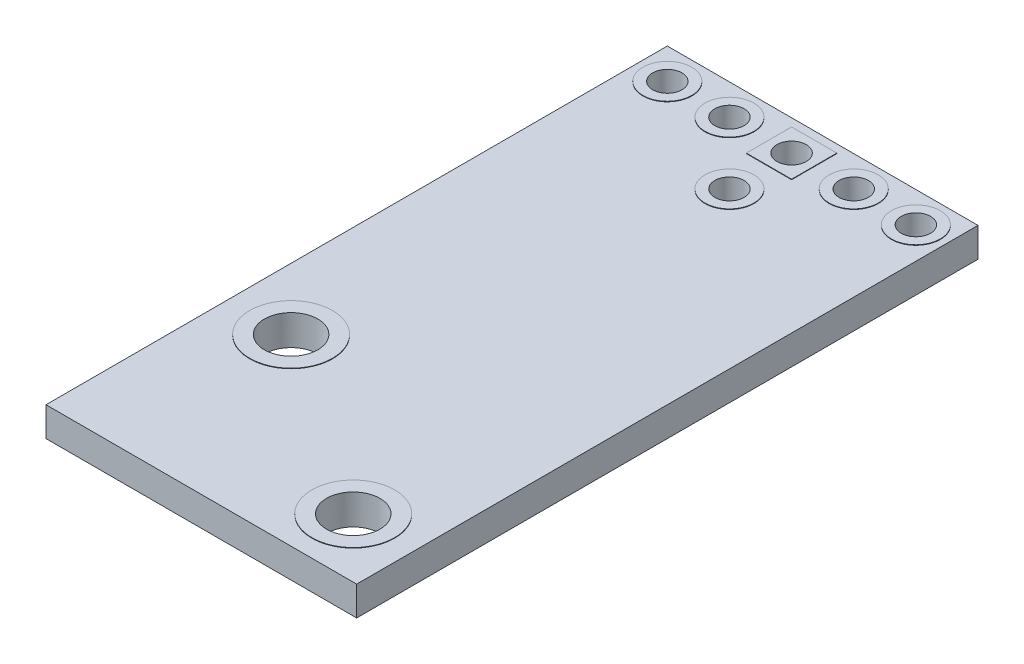
from build123d import *

# Parameters (mm, degrees)
ESQUISSE1_W             = 12.7
ESQUISSE1_H             = 25.4
BOSS_EXTRU_1_DEPTH      = 1.2
ESQUISSE2_R             = 1.0922
ESQUISSE2_R_2           = 0.6
ENL_V_MAT_EXTRU_1_DEPTH = 29.423405848
BOSS_EXTRU_2_START      = 0.02
ESQUISSE3_R             = 1
ESQUISSE3_R_2           = 0.6
ESQUISSE3_R_3           = 1.6922
ESQUISSE3_R_4           = 1.0922
ESQUISSE3_W             = 1.85
ESQUISSE3_H             = 1.85
BOSS_EXTRU_2_DEPTH      = 0.02
ESQUISSE4_R             = 1.6922
ESQUISSE4_R_2           = 1.0922
ESQUISSE4_R_3           = 1
ESQUISSE4_R_4           = 0.6
ESQUISSE4_W             = 1.8
ESQUISSE4_H             = 1.801050322
BOSS_EXTRU_3_DEPTH      = 0.02
ESQUISSE5_W             = 2.509277943
ESQUISSE5_H             = 2.515443245
ESQUISSE5_W_2           = 3.091420622
ESQUISSE5_H_2           = 3.048603163
ESQUISSE5_W_3           = 3.06104158
ESQUISSE5_H_3           = 3.068544132
ESQUISSE5_W_4           = 1.193610918
ESQUISSE5_H_4           = 2.854286977
ESQUISSE5_W_5           = 1.26351165
ESQUISSE5_H_5           = 2.853107199
ESQUISSE5_W_6           = 1.59060758
ESQUISSE5_H_6           = 2.920070631
BOSS_EXTRU_4_DEPTH      = 0.8
ESQUISSE6_W             = 1.618272423
ESQUISSE6_H             = 0.858257016
ESQUISSE6_W_2           = 1.550371274
ESQUISSE6_H_2           = 0.746748434
BOSS_EXTRU_5_DEPTH      = 0.6
BOSS_EXTRU_6_DEPTH      = 0.35


with BuildPart() as part:
    # Esquisse1 → Boss.-Extru.1 (new body)
    with BuildSketch(Plane(origin=(0, 0, 0), x_dir=(1, 0, 0), z_dir=(0, 1, 0))):
        with Locations((6.35, 12.7)):
            Rectangle(ESQUISSE1_W, ESQUISSE1_H)
    extrude(amount=BOSS_EXTRU_1_DEPTH)

    # Esquisse2 → Enlèv. mat.-Extru.1 (cut, through all)
    with BuildSketch(Plane(origin=(0, 1.2, 0), x_dir=(1, 0, 0), z_dir=(0, 1, 0))):
        with Locations(Location((2.54, 7.48, 0), (0, 0, 270))):
            Circle(ESQUISSE2_R)
        with Locations(Location((10.16, 2.4, 0), (0, 0, 270))):
            Circle(ESQUISSE2_R)
        with Locations(Location((6.35, 24.13, 0), (0, 0, 270))):
            Circle(ESQUISSE2_R_2)
        with Locations(Location((8.89, 24.13, 0), (0, 0, 270))):
            Circle(ESQUISSE2_R_2)
        with Locations(Location((11.43, 24.13, 0), (0, 0, 270))):
            Circle(ESQUISSE2_R_2)
        with Locations(Location((3.81, 24.13, 0), (0, 0, 270))):
            Circle(ESQUISSE2_R_2)
        with Locations(Location((1.27, 24.13, 0), (0, 0, 270))):
            Circle(ESQUISSE2_R_2)
        with Locations(Location((6.35, 21.59, 0), (0, 0, 270))):
            Circle(ESQUISSE2_R_2)
    extrude(amount=-ENL_V_MAT_EXTRU_1_DEPTH, mode=Mode.SUBTRACT)

    # Esquisse3 → Boss.-Extru.2 (add)
    # profile 1 of 8: a face of its own
    with BuildSketch(Plane(origin=(0, 1.2, 0), x_dir=(1, 0, 0), z_dir=(0, 1, 0)).offset(BOSS_EXTRU_2_START)):
        with Locations(Location((1.27, 24.13, 0), (0, 0, 90))):
            Circle(ESQUISSE3_R)
        with Locations(Location((1.27, 24.13, 0), (0, 0, 270))):
            Circle(ESQUISSE3_R_2, mode=Mode.SUBTRACT)
    # profile 2 of 8: a face of its own
    with BuildSketch(Plane(origin=(0, 1.2, 0), x_dir=(1, 0, 0), z_dir=(0, 1, 0)).offset(BOSS_EXTRU_2_START)):
        with Locations(Location((3.81, 24.13, 0), (0, 0, 90))):
            Circle(ESQUISSE3_R)
        with Locations(Location((3.81, 24.13, 0), (0, 0, 270))):
            Circle(ESQUISSE3_R_2, mode=Mode.SUBTRACT)
    # profile 3 of 8: a face of its own
    with BuildSketch(Plane(origin=(0, 1.2, 0), x_dir=(1, 0, 0), z_dir=(0, 1, 0)).offset(BOSS_EXTRU_2_START)):
        with Locations(Location((8.89, 24.13, 0), (0, 0, 90))):
            Circle(ESQUISSE3_R)
        with Locations(Location((8.89, 24.13, 0), (0, 0, 270))):
            Circle(ESQUISSE3_R_2, mode=Mode.SUBTRACT)
    # profile 4 of 8: a face of its own
    with BuildSketch(Plane(origin=(0, 1.2, 0), x_dir=(1, 0, 0), z_dir=(0, 1, 0)).offset(BOSS_EXTRU_2_START)):
        with Locations(Location((11.43, 24.13, 0), (0, 0, 90))):
            Circle(ESQUISSE3_R)
        with Locations(Location((11.43, 24.13, 0), (0, 0, 270))):
            Circle(ESQUISSE3_R_2, mode=Mode.SUBTRACT)
    # profile 5 of 8: a face of its own
    with BuildSketch(Plane(origin=(0, 1.2, 0), x_dir=(1, 0, 0), z_dir=(0, 1, 0)).offset(BOSS_EXTRU_2_START)):
        with Locations(Location((6.35, 21.59, 0), (0, 0, 90))):
            Circle(ESQUISSE3_R)
        with Locations(Location((6.35, 21.59, 0), (0, 0, 270))):
            Circle(ESQUISSE3_R_2, mode=Mode.SUBTRACT)
    # profile 6 of 8: a face of its own
    with BuildSketch(Plane(origin=(0, 1.2, 0), x_dir=(1, 0, 0), z_dir=(0, 1, 0)).offset(BOSS_EXTRU_2_START)):
        with Locations(Location((2.54, 7.48, 0), (0, 0, 90))):
            Circle(ESQUISSE3_R_3)
        with Locations(Location((2.54, 7.48, 0), (0, 0, 270))):
            Circle(ESQUISSE3_R_4, mode=Mode.SUBTRACT)
    # profile 7 of 8: a face of its own
    with BuildSketch(Plane(origin=(0, 1.2, 0), x_dir=(1, 0, 0), z_dir=(0, 1, 0)).offset(BOSS_EXTRU_2_START)):
        with Locations(Location((10.16, 2.4, 0), (0, 0, 90))):
            Circle(ESQUISSE3_R_3)
        with Locations(Location((10.16, 2.4, 0), (0, 0, 270))):
            Circle(ESQUISSE3_R_4, mode=Mode.SUBTRACT)
    # profile 8 of 8: a face of its own
    with BuildSketch(Plane(origin=(0, 1.2, 0), x_dir=(1, 0, 0), z_dir=(0, 1, 0)).offset(BOSS_EXTRU_2_START)):
        with Locations((6.35, 24.13)):
            Rectangle(ESQUISSE3_W, ESQUISSE3_H)
        with Locations(Location((6.35, 24.13, 0), (0, 0, 270))):
            Circle(ESQUISSE3_R_2, mode=Mode.SUBTRACT)
    extrude(amount=-BOSS_EXTRU_2_DEPTH)

    # Esquisse4 → Boss.-Extru.3 (add)
    # profile 1 of 8: a face of its own
    with BuildSketch(Plane(origin=(0, 0, 0), x_dir=(-1, 0, 0), z_dir=(0, -1, 0))):
        with Locations(Location((-2.54, 7.48, 0), (0, 0, 90))):
            Circle(ESQUISSE4_R)
        with Locations(Location((-2.54, 7.48, 0), (0, 0, 270))):
            Circle(ESQUISSE4_R_2, mode=Mode.SUBTRACT)
    # profile 2 of 8: a face of its own
    with BuildSketch(Plane(origin=(0, 0, 0), x_dir=(-1, 0, 0), z_dir=(0, -1, 0))):
        with Locations(Location((-10.16, 2.4, 0), (0, 0, 90))):
            Circle(ESQUISSE4_R)
        with Locations(Location((-10.16, 2.4, 0), (0, 0, 270))):
            Circle(ESQUISSE4_R_2, mode=Mode.SUBTRACT)
    # profile 3 of 8: a face of its own
    with BuildSketch(Plane(origin=(0, 0, 0), x_dir=(-1, 0, 0), z_dir=(0, -1, 0))):
        with Locations(Location((-6.35, 21.59, 0), (0, 0, 90))):
            Circle(ESQUISSE4_R_3)
        with Locations(Location((-6.35, 21.59, 0), (0, 0, 270))):
            Circle(ESQUISSE4_R_4, mode=Mode.SUBTRACT)
    # profile 4 of 8: a face of its own
    with BuildSketch(Plane(origin=(0, 0, 0), x_dir=(-1, 0, 0), z_dir=(0, -1, 0))):
        with Locations(Location((-8.89, 24.13, 0), (0, 0, 90))):
            Circle(ESQUISSE4_R_3)
        with Locations(Location((-8.89, 24.13, 0), (0, 0, 270))):
            Circle(ESQUISSE4_R_4, mode=Mode.SUBTRACT)
    # profile 5 of 8: a face of its own
    with BuildSketch(Plane(origin=(0, 0, 0), x_dir=(-1, 0, 0), z_dir=(0, -1, 0))):
        with Locations(Location((-11.43, 24.13, 0), (0, 0, 90))):
            Circle(ESQUISSE4_R_3)
        with Locations(Location((-11.43, 24.13, 0), (0, 0, 270))):
            Circle(ESQUISSE4_R_4, mode=Mode.SUBTRACT)
    # profile 6 of 8: a face of its own
    with BuildSketch(Plane(origin=(0, 0, 0), x_dir=(-1, 0, 0), z_dir=(0, -1, 0))):
        with Locations(Location((-3.81, 24.13, 0), (0, 0, 90))):
            Circle(ESQUISSE4_R_3)
        with Locations(Location((-3.81, 24.13, 0), (0, 0, 270))):
            Circle(ESQUISSE4_R_4, mode=Mode.SUBTRACT)
    # profile 7 of 8: a face of its own
    with BuildSketch(Plane(origin=(0, 0, 0), x_dir=(-1, 0, 0), z_dir=(0, -1, 0))):
        with Locations(Location((-1.27, 24.13, 0), (0, 0, 90))):
            Circle(ESQUISSE4_R_3)
        with Locations(Location((-1.27, 24.13, 0), (0, 0, 270))):
            Circle(ESQUISSE4_R_4, mode=Mode.SUBTRACT)
    # profile 8 of 8: a face of its own
    with BuildSketch(Plane(origin=(0, 0, 0), x_dir=(-1, 0, 0), z_dir=(0, -1, 0))):
        with Locations((-6.35, 24.13)):
            Rectangle(ESQUISSE4_W, ESQUISSE4_H)
        with Locations(Location((-6.35, 24.13, 0), (0, 0, 270))):
            Circle(ESQUISSE4_R_4, mode=Mode.SUBTRACT)
    extrude(amount=BOSS_EXTRU_3_DEPTH)

    # Esquisse5 → Boss.-Extru.4 (add)
    with BuildSketch(Plane.XZ):
        with Locations((4.605899052, -2.623946332)):
            Rectangle(ESQUISSE5_W, ESQUISSE5_H)
        with Locations((7.141800063, -7.814451049)):
            Rectangle(ESQUISSE5_W_2, ESQUISSE5_H_2)
        with Locations((9.635983842, -15.671495352)):
            Rectangle(ESQUISSE5_W_3, ESQUISSE5_H_3)
        with Locations((2.186822026, -14.841307754)):
            Rectangle(ESQUISSE5_W_4, ESQUISSE5_H_4)
        with Locations((2.491632252, -18.172449209)):
            Rectangle(ESQUISSE5_W_5, ESQUISSE5_H_5)
        with Locations((10.037187645, -21.174630377)):
            Rectangle(ESQUISSE5_W_6, ESQUISSE5_H_6)
    extrude(amount=BOSS_EXTRU_4_DEPTH)

    # Esquisse6 → Boss.-Extru.5 (add)
    with BuildSketch(Plane.XZ):
        Polygon((0.726627768, -2.066459052), (1.460485759, -2.066459052), (1.487334222, -3.552074009), (0.753476231, -3.552074009), align=None)
        Polygon((11.086694799, -7.026420932), (11.800319135, -7.026420932), (11.877628438, -8.554766384), (11.164004102, -8.554766384), align=None)
        Polygon((11.125349451, -10.627256859), (11.883196388, -10.627256859), (11.877628438, -12.112618353), (11.119781502, -12.112618353), align=None)
        Polygon((8.272243219, -10.085536784), (8.272243219, -10.819480111), (9.775079555, -10.871904634), (9.775079555, -10.137961308), align=None)
        Polygon((8.215171902, -11.68219873), (8.215171902, -12.455524532), (9.775079555, -12.461131564), (9.775079555, -11.687805762), align=None)
        Polygon((0.753476231, -12.068861631), (1.487334222, -12.068861631), (1.486411635, -10.570920499), (0.752553644, -10.570920499), align=None)
        Polygon((2.936295169, -12.12556249), (2.044305287, -12.12556249), (2.06534031, -10.526061527), (2.957330192, -10.526061527), align=None)
        Polygon((3.504383436, -12.12556249), (4.275795617, -12.12556249), (4.244730134, -10.579949827), (3.473317953, -10.579949827), align=None)
        Polygon((4.992958725, -12.174767916), (5.764370906, -12.174767916), (5.733305423, -10.629155253), (4.961893242, -10.629155253), align=None)
        Polygon((3.72603955, -22.142648569), (4.497451731, -22.142648569), (4.466386248, -20.597035906), (3.694974067, -20.597035906), align=None)
        with Locations((5.743109512, -19.098625419)):
            Rectangle(ESQUISSE6_W, ESQUISSE6_H)
        with Locations((10.517946357, -18.5651166)):
            Rectangle(ESQUISSE6_W_2, ESQUISSE6_H_2)
    extrude(amount=BOSS_EXTRU_5_DEPTH)

    # Esquisse7 → Boss.-Extru.6 (add)
    with BuildSketch(Plane.XZ):
        Polygon((4.982382693, -13.271878721), (4.982382693, -14.057624892), (6.524144098, -14.040635785), (6.524144098, -13.254889615), align=None)
        Polygon((5.057452454, -15.733592818), (6.59826695, -15.733592818), (6.58021053, -14.975223183), (5.039396034, -14.975223183), align=None)
        Polygon((5.048424244, -17.026123559), (5.048424244, -17.803582581), (6.581851825, -17.778567896), (6.581851825, -17.001108874), align=None)
        Polygon((1.179677832, -20.142278538), (1.179677832, -20.920603911), (2.727025883, -20.923704809), (2.727025883, -20.145379436), align=None)
        Polygon((1.134741003, -22.506266059), (1.122293095, -21.74319572), (2.689519452, -21.721611514), (2.701967359, -22.484681852), align=None)
    extrude(amount=BOSS_EXTRU_6_DEPTH)


solid = part.part
